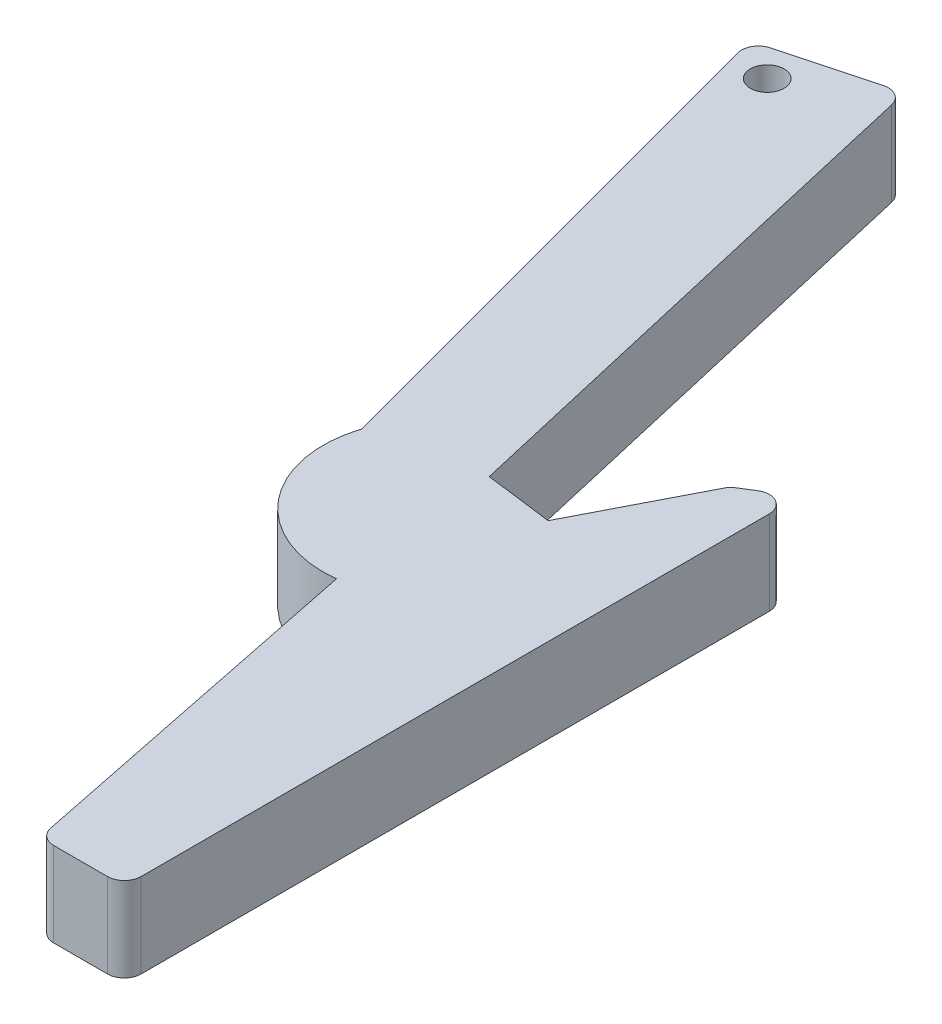
from build123d import *

# Parameters (mm, degrees)
BOSS_EXTRUDE1_DEPTH = 10
SKETCH2_R           = 2
CUT_EXTRUDE1_DEPTH  = 127.711975624
FILLET1_R           = 2
L_EK1_SCALE         = 2
L_EK2_SCALE         = 0.4


with BuildPart() as part:
    # Sketch1 → Boss-Extrude1 (new body)
    with BuildSketch(Plane(origin=(0, 0, 0), x_dir=(1, 0, 0), z_dir=(0, 1, 0))):
        with BuildLine():
            Line((5.38708673, 8.005739827), (-9.101800665, 4.12345415))
            Line((-9.101800665, 4.12345415), (7.721437267, -58.661724559))
            ThreePointArc((7.721437267, -58.661724559), (10.067992025, -70.873983123), (21.600150017, -75.52746682))
            Line((21.600150017, -75.52746682), (30.569895869, -119.624446982))
            Line((30.569895869, -119.624446982), (40.569895869, -119.624446982))
            Line((40.569895869, -119.624446982), (40.569895869, -39.624446982))
            Line((40.569895869, -39.624446982), (35.479571099, -42.800701652))
            Line((35.479571099, -42.800701652), (28.162650962, -57.029639761))
            Line((28.162650962, -57.029639761), (20.162650962, -55.994260173))
            Line((20.162650962, -55.994260173), (5.38708673, 8.005739827))
        make_face()
    extrude(amount=BOSS_EXTRUDE1_DEPTH)

    # Sketch2 → Cut-Extrude1 (cut, through all)
    with BuildSketch(Plane(origin=(0, 10, 0), x_dir=(1, 0, 0), z_dir=(0, 1, 0))):
        with Locations(Location((-4.202821179, 1.295027025, 0), (0, 0, 270))):
            Circle(SKETCH2_R)
    extrude(amount=-CUT_EXTRUDE1_DEPTH, mode=Mode.SUBTRACT)

    # Fillet1
    fillet1_edges = [part.edges().sort_by_distance(p)[0] for p in [
        (35.479571099, 5, 42.800701652),
        (40.569895869, 5, 39.624446982),
        (40.569895869, 5, 119.624446982),
        (30.569895869, 5, 119.624446982),
        (-9.101800665, 5, -4.12345415),
        (5.38708673, 5, -8.005739827),
    ]]
    fillet(fillet1_edges, radius=FILLET1_R)


with BuildPart() as part_1:
    # Ölçek1: scaled about (20.340725974, 5, 57.172914763)
    add(part.part.scale(L_EK1_SCALE).moved(Location((-20.340725974, -5, -57.172914763))))


with BuildPart() as part_2:
    # Ölçek2: scaled about (20.340725974, 5, 57.172914763)
    add(part_1.part.scale(L_EK2_SCALE).moved(Location((12.204435584, 3, 34.303748858))))


solid = part_2.part
